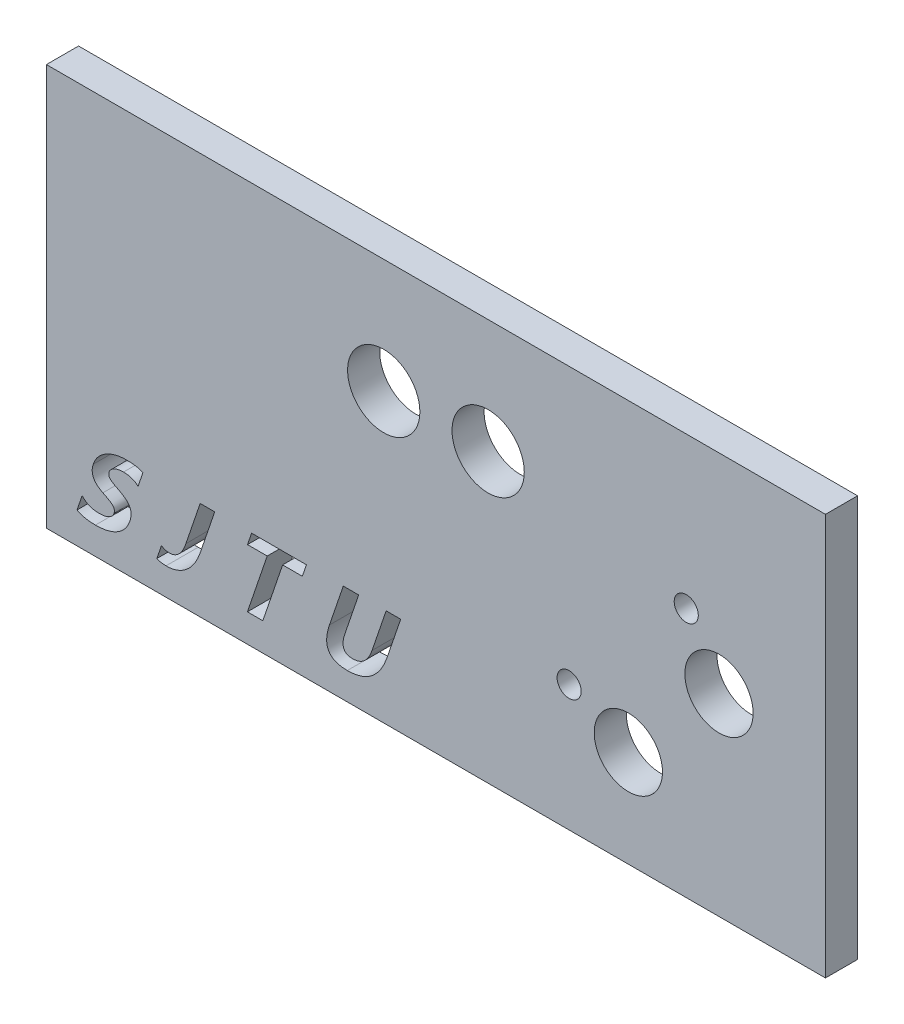
from build123d import *

# Parameters (mm, degrees)
SKETCH_1_W      = 194
SKETCH_1_H      = 100
SKETCH_1_R      = 3
SKETCH_1_R_2    = 8.5
SKETCH_1_R_3    = 9
EXTRUDE_1_DEPTH = 8


with BuildPart() as part:
    # 草图1 → 凸台-拉伸1 (new body)
    with BuildSketch(Plane.XY):
        with Locations((37.667429801, 18.608937747)):
            Rectangle(SKETCH_1_W, SKETCH_1_H)
        with Locations((100.003237271, 30.966101622)):
            Circle(SKETCH_1_R, mode=Mode.SUBTRACT)
        with Locations((70.834877583, -0.015055988)):
            Circle(SKETCH_1_R, mode=Mode.SUBTRACT)
        with Locations((85.581180266, -7.264183875)):
            Circle(SKETCH_1_R_2, mode=Mode.SUBTRACT)
        with Locations((108.155772509, 16.699164955)):
            Circle(SKETCH_1_R_2, mode=Mode.SUBTRACT)
        with Locations((24.667429801, 40.200166996)):
            Circle(SKETCH_1_R_3, mode=Mode.SUBTRACT)
        with Locations((50.667429801, 40.200166996)):
            Circle(SKETCH_1_R_3, mode=Mode.SUBTRACT)
        with BuildLine():
            add(Edge.make_bspline(
                [(-50.442741782, -19.917727562), (-50.311387023, -20.054506094), (-50.050501666, -20.326163676), (-49.605333925, -20.671909751), (-49.128318194, -20.969970704), (-48.612293992, -21.208813435), (-48.060391725, -21.397602911), (-47.472155673, -21.528575636), (-46.84814339, -21.610844981), (-46.420364266, -21.62023316), (-46.201125928, -21.625044635)],
                knots=[0, 0, 0, 0, 0.964147955, 1.914906522, 2.860059829, 3.821864369, 4.802324704, 5.823468209, 6.884519635, 8, 8, 8, 8], degree=3))
            add(Edge.make_bspline(
                [(-46.201125928, -21.625044635), (-45.957354583, -21.619041229), (-45.493267862, -21.607612073), (-44.832494325, -21.511421403), (-44.244014006, -21.350504324), (-43.729174748, -21.124014924), (-43.294079698, -20.843693388), (-42.935374435, -20.525808616), (-42.662624581, -20.163221322), (-42.549035461, -19.893800453), (-42.49304666, -19.76100119)],
                knots=[0, 0, 0, 0, 1.323457312, 2.519569981, 3.616658133, 4.62741878, 5.561792658, 6.416604884, 7.219534455, 8, 8, 8, 8], degree=3))
            add(Edge.make_bspline(
                [(-42.49304666, -19.76100119), (-42.461140507, -19.64526342), (-42.399313816, -19.420990589), (-42.394969701, -19.070939469), (-42.481184279, -18.735124765), (-42.610606483, -18.459996843), (-42.780468058, -18.244353073), (-42.966887347, -18.064753226), (-43.212366108, -17.87358106), (-43.513623709, -17.667486074), (-43.871521474, -17.448399), (-44.286289416, -17.214656801), (-44.760382084, -16.96958395), (-45.097075087, -16.803718854), (-45.274106111, -16.71650805)],
                knots=[0, 0, 0, 0, 0.946980014, 1.835026621, 2.730657396, 3.67042659, 4.215608292, 4.893285495, 5.713028916, 6.673906356, 7.779232265, 9.031174357, 10.439010499, 12, 12, 12, 12], degree=3))
            add(Edge.make_bspline(
                [(-45.274106111, -16.71650805), (-45.415215294, -16.645074829), (-45.689884005, -16.506030222), (-46.073097388, -16.27120096), (-46.422648858, -16.027395583), (-46.736178105, -15.772387192), (-47.012336906, -15.502893494), (-47.254025523, -15.222961076), (-47.459365703, -14.928242092), (-47.625371675, -14.619559826), (-47.761867794, -14.302707861), (-47.854542371, -13.970450471), (-47.915017926, -13.627634306), (-47.938319909, -13.272044863), (-47.922513863, -12.904961359), (-47.87807346, -12.525972151), (-47.78782985, -12.135414923), (-47.706766326, -11.87526301), (-47.665016934, -11.741279391)],
                knots=[0, 0, 0, 0, 1.232000636, 2.398086503, 3.498638455, 4.551104879, 5.543362937, 6.50162045, 7.429044926, 8.335979665, 9.22878339, 10.111573572, 11.017225253, 11.937340666, 12.882076209, 13.876901563, 14.90656037, 16, 16, 16, 16], degree=3))
            add(Edge.make_bspline(
                [(-47.665016934, -11.741279391), (-47.593179351, -11.545186769), (-47.450841331, -11.15665149), (-47.173248897, -10.605837624), (-46.856388405, -10.085651651), (-46.492254299, -9.599908956), (-46.077668276, -9.152613218), (-45.624603249, -8.732666258), (-45.119411094, -8.352781257), (-44.575918287, -8.004018675), (-43.995838999, -7.695905728), (-43.390907116, -7.425145529), (-42.762949577, -7.194111895), (-42.111911716, -7.007809293), (-41.438710968, -6.864607948), (-40.743753856, -6.762245722), (-40.025608532, -6.696190422), (-39.538734638, -6.689442372), (-39.291827148, -6.686020245)],
                knots=[0, 0, 0, 0, 0.957452443, 1.897083374, 2.824189697, 3.749274099, 4.676871196, 5.618879403, 6.579680564, 7.572759344, 8.578898665, 9.590155828, 10.6114317, 11.646065757, 12.694297164, 13.76674884, 14.867455318, 16, 16, 16, 16], degree=3))
            add(Edge.make_bspline(
                [(-39.291827148, -6.686020245), (-39.087252184, -6.687512607), (-38.688926986, -6.690418367), (-38.107190546, -6.725314897), (-37.557604504, -6.777776138), (-37.039616839, -6.849361279), (-36.555649744, -6.946724644), (-36.103919531, -7.061917442), (-35.684795481, -7.201395574), (-35.421868652, -7.314467843), (-35.293637361, -7.369613995)],
                knots=[0, 0, 0, 0, 1.201419633, 2.339268226, 3.421537804, 4.443610957, 5.409003315, 6.319501297, 7.180408791, 8, 8, 8, 8], degree=3))
            Line((-35.293637361, -7.369613995), (-36.5141023, -10.954312928))
            add(Edge.make_bspline(
                [(-36.5141023, -10.954312928), (-36.625123369, -10.851407775), (-36.847536875, -10.645253249), (-37.225144501, -10.38681049), (-37.631248472, -10.164263504), (-38.071076339, -9.984271091), (-38.542706765, -9.844828392), (-39.046102122, -9.745441838), (-39.581546947, -9.684498024), (-39.949688719, -9.677447323), (-40.138816477, -9.673825123)],
                knots=[0, 0, 0, 0, 0.919704151, 1.842484741, 2.774360143, 3.73235846, 4.727063072, 5.761307679, 6.849902699, 8, 8, 8, 8], degree=3))
            add(Edge.make_bspline(
                [(-40.138816477, -9.673825123), (-40.356988369, -9.679269023), (-40.779750041, -9.689817918), (-41.391085203, -9.780097676), (-41.95549513, -9.933210021), (-42.389014885, -10.112087897), (-42.704031566, -10.281730086), (-42.915364191, -10.419635172), (-43.106492309, -10.565196904), (-43.273868655, -10.723830891), (-43.423536145, -10.89003709), (-43.544531741, -11.071719605), (-43.652687439, -11.259151706), (-43.702050591, -11.393618346), (-43.726850013, -11.461172684)],
                knots=[0, 0, 0, 0, 1.843339866, 3.571924121, 5.208362892, 6.775143121, 7.523439355, 8.229620627, 8.906118371, 9.550816363, 10.176547463, 10.791536516, 11.392883247, 12, 12, 12, 12], degree=3))
            add(Edge.make_bspline(
                [(-43.726850013, -11.461172684), (-43.756505793, -11.56700184), (-43.813863585, -11.771687965), (-43.812350342, -12.089484112), (-43.737137103, -12.393941045), (-43.60923508, -12.635845663), (-43.453638795, -12.825778318), (-43.284855779, -12.980221062), (-43.069184793, -13.146160804), (-42.807628638, -13.326475534), (-42.498125212, -13.518657791), (-42.139756327, -13.720821754), (-41.737082267, -13.938312424), (-41.449782218, -14.080852261), (-41.29925855, -14.15553244)],
                knots=[0, 0, 0, 0, 0.985068841, 1.905239841, 2.822198116, 3.784146083, 4.338685787, 5.025034874, 5.83734345, 6.78620308, 7.882445121, 9.11433959, 10.488130473, 12, 12, 12, 12], degree=3))
            add(Edge.make_bspline(
                [(-41.29925855, -14.15553244), (-41.121288213, -14.246674538), (-40.778170617, -14.422391785), (-40.302354286, -14.712143039), (-39.87210516, -14.996024449), (-39.497640025, -15.289652852), (-39.175354775, -15.587456374), (-38.901299319, -15.887113707), (-38.683499806, -16.194391864), (-38.515544301, -16.507221142), (-38.396120117, -16.829093687), (-38.307339136, -17.161552335), (-38.258193922, -17.510726622), (-38.245171756, -17.875006781), (-38.270400584, -18.253188001), (-38.327368178, -18.645832039), (-38.421244206, -19.052535126), (-38.507392011, -19.32471948), (-38.551545135, -19.464221464)],
                knots=[0, 0, 0, 0, 1.425392977, 2.748083867, 3.970420074, 5.099447182, 6.13710019, 7.096868814, 7.989759823, 8.815987267, 9.621264907, 10.432605534, 11.265498043, 12.130074653, 13.027492878, 13.964638907, 14.956821338, 16, 16, 16, 16], degree=3))
            add(Edge.make_bspline(
                [(-38.551545135, -19.464221464), (-38.625273101, -19.669342237), (-38.770691997, -20.073916485), (-39.057350746, -20.645094908), (-39.37462085, -21.184632488), (-39.74119592, -21.683887724), (-40.149543298, -22.146092274), (-40.600550956, -22.570263248), (-41.095670878, -22.95649631), (-41.631394094, -23.305145664), (-42.204782567, -23.614836787), (-42.812737656, -23.882728732), (-43.452523969, -24.109092294), (-44.126106255, -24.29191183), (-44.831242456, -24.435190657), (-45.569631373, -24.537090985), (-46.341095066, -24.602869098), (-46.866797191, -24.609479397), (-47.134814952, -24.612849513)],
                knots=[0, 0, 0, 0, 0.972434929, 1.918002384, 2.848337662, 3.764599685, 4.678789293, 5.59870028, 6.525015551, 7.478999051, 8.449456145, 9.431620202, 10.442543953, 11.476809515, 12.545558458, 13.653152325, 14.803510906, 16, 16, 16, 16], degree=3))
            add(Edge.make_bspline(
                [(-47.134814952, -24.612849513), (-47.377185349, -24.609216599), (-47.846761371, -24.602178077), (-48.529251752, -24.560389981), (-49.167198937, -24.484129049), (-49.761412027, -24.376974143), (-50.314490677, -24.246835509), (-50.822185144, -24.078607862), (-51.289063834, -23.886149924), (-51.57241843, -23.724325455), (-51.709891172, -23.645814452)],
                knots=[0, 0, 0, 0, 1.229532305, 2.38213453, 3.466882367, 4.486638309, 5.443951203, 6.346193451, 7.197636729, 8, 8, 8, 8], degree=3))
            Line((-51.709891172, -23.645814452), (-50.442741782, -19.917727562))
        make_face(mode=Mode.SUBTRACT)
        with BuildLine():
            add(Edge.make_bspline(
                [(-21.014864495, -17.476797684), (-21.115297261, -17.756909247), (-21.312194647, -18.306065032), (-21.652156013, -19.096005394), (-22.030944212, -19.831877671), (-22.432544784, -20.523871547), (-22.8733274, -21.160406179), (-23.345887865, -21.74770595), (-23.849467815, -22.286568057), (-24.386680978, -22.77295109), (-24.949258981, -23.208234913), (-25.539268279, -23.583149811), (-26.151740084, -23.901314039), (-26.787219893, -24.163402259), (-27.446626449, -24.362716819), (-28.128124825, -24.506612808), (-28.833281385, -24.5953835), (-29.312211897, -24.606977361), (-29.554784465, -24.612849513)],
                knots=[0, 0, 0, 0, 1.194810306, 2.342413087, 3.450353661, 4.516756841, 5.553104302, 6.556246153, 7.541511972, 8.511646622, 9.463369161, 10.394552734, 11.31491085, 12.23169003, 13.150910905, 14.077138657, 15.026093763, 16, 16, 16, 16], degree=3))
            add(Edge.make_bspline(
                [(-29.554784465, -24.612849513), (-29.766336161, -24.608576496), (-30.175643412, -24.600309123), (-30.768172658, -24.512375563), (-31.320842077, -24.382625366), (-31.662565294, -24.243681808), (-31.82898416, -24.176016434)],
                knots=[0, 0, 0, 0, 1.087681878, 2.10443163, 3.076860092, 4, 4, 4, 4], degree=3))
            Line((-31.82898416, -24.176016434), (-30.67187669, -20.771386098))
            add(Edge.make_bspline(
                [(-30.67187669, -20.771386098), (-30.607371505, -20.822918723), (-30.477714173, -20.926500824), (-30.262711058, -21.054932909), (-30.034437882, -21.166617054), (-29.790538622, -21.255737409), (-29.531815777, -21.326429566), (-29.258397712, -21.375399176), (-28.969717437, -21.406332736), (-28.772346127, -21.409834135), (-28.671114495, -21.411630001)],
                knots=[0, 0, 0, 0, 0.922831603, 1.854918853, 2.794937497, 3.762923304, 4.755522848, 5.792252478, 6.867647559, 8, 8, 8, 8], degree=3))
            add(Edge.make_bspline(
                [(-28.671114495, -21.411630001), (-28.560933951, -21.408113643), (-28.341818963, -21.401120697), (-28.018392218, -21.354700793), (-27.70618513, -21.272962946), (-27.403611837, -21.163435832), (-27.113134398, -21.018050758), (-26.830879557, -20.844154066), (-26.559945042, -20.635787), (-26.3014336, -20.395547424), (-26.051354997, -20.124997498), (-25.812613214, -19.822978203), (-25.587047722, -19.486324004), (-25.364590086, -19.123642647), (-25.160118737, -18.723655633), (-24.959341632, -18.295465681), (-24.773155112, -17.833955281), (-24.660552257, -17.513936701), (-24.602898032, -17.350082745)],
                knots=[0, 0, 0, 0, 0.858213048, 1.706720024, 2.538272997, 3.368201841, 4.208408417, 5.063734354, 5.946870734, 6.865901715, 7.809401548, 8.814040267, 9.86102373, 10.964237385, 12.125962279, 13.357712689, 14.647112208, 16, 16, 16, 16], degree=3))
            Line((-24.602898032, -17.350082745), (-21.048210532, -6.899434879))
            Line((-21.048210532, -6.899434879), (-17.420161751, -6.899434879))
            Line((-17.420161751, -6.899434879), (-21.014864495, -17.476797684))
        make_face(mode=Mode.SUBTRACT)
        Polygon((4.398149987, -9.887239757), (-0.510386599, -9.887239757), (-5.44226541, -24.399434879), (-9.283728824, -24.399434879), (-4.351850013, -9.887239757), (-9.260386599, -9.887239757), (-8.243332483, -6.899434879), (5.415204102, -6.899434879), align=None, mode=Mode.SUBTRACT)
        with BuildLine():
            add(Edge.make_bspline(
                [(25.516194956, -16.823215367), (25.403077404, -17.139165756), (25.182047861, -17.756526802), (24.796393495, -18.641245331), (24.374098668, -19.46427997), (23.916501421, -20.228315797), (23.423926632, -20.931390041), (22.889938664, -21.569622784), (22.327697126, -22.155154215), (21.720638801, -22.671359929), (21.082716965, -23.132656492), (20.403976378, -23.525874154), (19.692767045, -23.865673203), (18.941628322, -24.137992841), (18.156728732, -24.352871225), (17.334060102, -24.499812497), (16.477327281, -24.597492681), (15.89280749, -24.607674843), (15.595749072, -24.612849513)],
                knots=[0, 0, 0, 0, 1.183314634, 2.312174269, 3.40095861, 4.443708394, 5.450855262, 6.425100641, 7.375996463, 8.310171629, 9.231625969, 10.148717045, 11.072835998, 12.007948389, 12.962747291, 13.939261511, 14.952713447, 16, 16, 16, 16], degree=3))
            add(Edge.make_bspline(
                [(15.595749072, -24.612849513), (15.315357788, -24.607705596), (14.777460701, -24.597837607), (14.008762908, -24.506523554), (13.313480976, -24.364360837), (12.692825133, -24.156793227), (12.143926798, -23.893148513), (11.67337229, -23.561397392), (11.274514053, -23.173142697), (10.955051029, -22.720527726), (10.712910216, -22.207905545), (10.546780335, -21.638681033), (10.458231705, -21.010109663), (10.450868, -20.324605547), (10.506890901, -19.57960609), (10.65049605, -18.778073773), (10.859644427, -17.916652853), (11.048935818, -17.331150609), (11.147387791, -17.02662619)],
                knots=[0, 0, 0, 0, 1.213203414, 2.327385407, 3.345560749, 4.279732996, 5.153326052, 5.971589157, 6.760895168, 7.551183021, 8.356040421, 9.203978234, 10.108246669, 11.094736936, 12.165957465, 13.337381273, 14.615150616, 16, 16, 16, 16], degree=3))
            Line((11.147387791, -17.02662619), (14.592033371, -6.899434879))
            Line((14.592033371, -6.899434879), (18.433496785, -6.899434879))
            Line((18.433496785, -6.899434879), (14.978847395, -17.056637623))
            add(Edge.make_bspline(
                [(14.978847395, -17.056637623), (14.921254172, -17.231648058), (14.810558527, -17.568022584), (14.683260751, -18.062468301), (14.595934158, -18.522645159), (14.544040279, -18.949322761), (14.528266734, -19.342257257), (14.55342667, -19.702811837), (14.61896999, -20.028365659), (14.723765266, -20.320282017), (14.862620606, -20.580992545), (15.047020858, -20.805318676), (15.270511234, -20.993359935), (15.531752257, -21.148744403), (15.83150385, -21.267333741), (16.168422846, -21.354335464), (16.543589673, -21.402787845), (16.806072425, -21.408599729), (16.94292895, -21.411630001)],
                knots=[0, 0, 0, 0, 1.483536992, 2.851395975, 4.108496304, 5.2532933, 6.310227307, 7.270756872, 8.157359169, 8.975714066, 9.760885247, 10.524269892, 11.299115845, 12.102049217, 12.961480739, 13.886436085, 14.898003726, 16, 16, 16, 16], degree=3))
            add(Edge.make_bspline(
                [(16.94292895, -21.411630001), (17.082048673, -21.408649643), (17.355655139, -21.402788181), (17.756854759, -21.349941675), (18.144028506, -21.272327215), (18.513651523, -21.153636012), (18.87020533, -21.006734907), (19.211150668, -20.82641176), (19.536367221, -20.610918755), (19.846051591, -20.363814924), (20.141361197, -20.085758865), (20.419475006, -19.772767791), (20.681347979, -19.426373861), (20.928356839, -19.048508596), (21.159477552, -18.638361225), (21.375641206, -18.195295865), (21.575054224, -17.718000649), (21.693995343, -17.386209681), (21.754762029, -17.216698598)],
                knots=[0, 0, 0, 0, 0.97085159, 1.909371764, 2.821069662, 3.724305604, 4.614985267, 5.510654771, 6.412522755, 7.334860333, 8.273637162, 9.24100854, 10.254562793, 11.302819401, 12.390550867, 13.539382814, 14.742877526, 16, 16, 16, 16], degree=3))
            Line((21.754762029, -17.216698598), (25.262765078, -6.899434879))
            Line((25.262765078, -6.899434879), (28.890813859, -6.899434879))
            Line((28.890813859, -6.899434879), (25.516194956, -16.823215367))
        make_face(mode=Mode.SUBTRACT)
    extrude(amount=EXTRUDE_1_DEPTH)


solid = part.part
